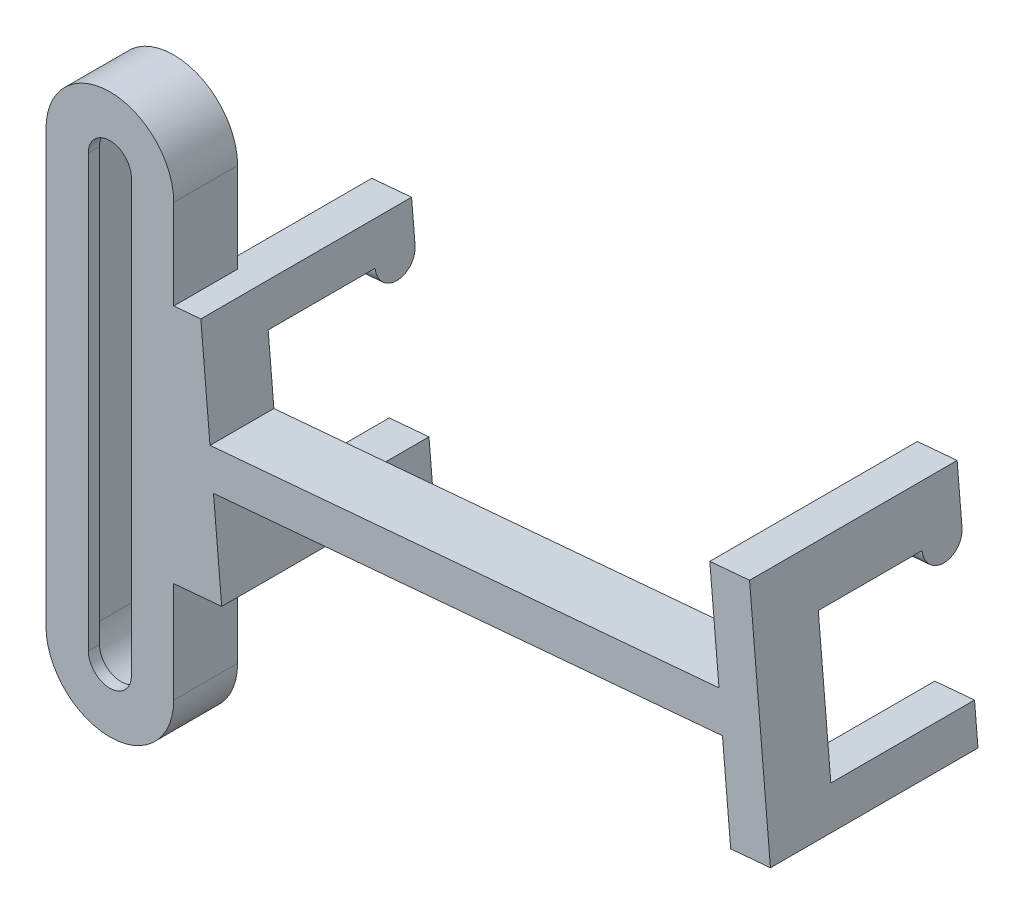
from build123d import *

# Parameters (mm, degrees)
SKETCH1_R           = 10.16
SKETCH1_W           = 20.32
SKETCH1_H           = 68.58
BOSS_EXTRUDE1_DEPTH = 10.16
SKETCH2_R           = 6.604
SKETCH2_W           = 13.208
SKETCH2_H           = 68.58
CUT_EXTRUDE1_DEPTH  = 47.714598361
BOSS_EXTRUDE2_DEPTH = 10.16
SKETCH4_W           = 33.528
SKETCH4_H           = 38.1
BOSS_EXTRUDE3_DEPTH = 6.35
SKETCH5_W           = 23.368
SKETCH5_H           = 25.4
CUT_EXTRUDE2_DEPTH  = 102.646087633
SKETCH6_W           = 33.02
SKETCH6_H           = 38.1
BOSS_EXTRUDE4_DEPTH = 6.35
BOSS_EXTRUDE5_REACH = 110.063
SKETCH7_W           = 10.16
SKETCH7_H           = 14.989497654
SKETCH8_W           = 22.86
SKETCH8_H           = 22.86
CUT_EXTRUDE3_DEPTH  = 122.879251037
SKETCH9_R           = 3.175
BOSS_EXTRUDE6_DEPTH = 6.35
SKETCH10_R          = 3.175
BOSS_EXTRUDE7_DEPTH = 6.35
SKETCH13_R          = 2.286
CUT_EXTRUDE4_DEPTH  = 81.28
BOSS_EXTRUDE8_START = -1.778
BOSS_EXTRUDE8_DEPTH = 1.778


with BuildPart() as part:
    # Sketch1 → Boss-Extrude1 (new body)
    with BuildSketch(Plane.XY):
        with Locations((0, 34.29)):
            Circle(SKETCH1_R)
        with Locations((0, -34.29)):
            Circle(SKETCH1_R)
        Rectangle(SKETCH1_W, SKETCH1_H)
    extrude(amount=BOSS_EXTRUDE1_DEPTH)

    # Sketch2 → Cut-Extrude1 (cut, through all)
    with BuildSketch(Plane.XY.offset(10.16)):
        with Locations((0, 34.29)):
            Circle(SKETCH2_R)
        with Locations((0, -34.29)):
            Circle(SKETCH2_R)
        Rectangle(SKETCH2_W, SKETCH2_H)
    extrude(amount=-CUT_EXTRUDE1_DEPTH, mode=Mode.SUBTRACT)

    # Sketch3 → Boss-Extrude2 (add)
    with BuildSketch(Plane(origin=(0, 0, 0), x_dir=(-1, 0, 0), z_dir=(0, 0, -1))):
        Polygon((-9.606561034, 3.138708349), (-103.22893876, 11.329605052), (-103.782377727, 5.003768719), (-10.16, -3.187127984), align=None)
    extrude(amount=-BOSS_EXTRUDE2_DEPTH)

    # Sketch4 → Boss-Extrude3 (add)
    with BuildSketch(Plane(origin=(-103.08224956, 1291.177707373, 0), x_dir=(0, 0, -1), z_dir=(-0.9961946980917459, -0.08715574274765499, 0))):
        with Locations((6.604, 1295.248596403)):
            Rectangle(SKETCH4_W, SKETCH4_H)
    extrude(amount=-BOSS_EXTRUDE3_DEPTH)

    # Sketch5 → Cut-Extrude2 (cut, through all)
    with BuildSketch(Plane(origin=(16.131940235, 1.411361891, 0), x_dir=(0, 0, 1), z_dir=(0.9961946980917458, 0.08715574274765524, 0))):
        with Locations((-11.684, 0)):
            Rectangle(SKETCH5_W, SKETCH5_H)
    extrude(amount=-CUT_EXTRUDE2_DEPTH, mode=Mode.SUBTRACT)

    # Sketch6 → Boss-Extrude4 (add)
    with BuildSketch(Plane(origin=(103.428481629, 9.048819628, 0), x_dir=(0, 0, -1), z_dir=(0.9961946980917468, 0.08715574274764347, 0))):
        with Locations((6.35, 0)):
            Rectangle(SKETCH6_W, SKETCH6_H)
    extrude(amount=-BOSS_EXTRUDE4_DEPTH)

    # Sketch7 → Boss-Extrude5 (add, up to next)
    with BuildSketch(Plane(origin=(9.806103902, 0.857922925, 0), x_dir=(0, 0, 1), z_dir=(-0.9961946980917458, -0.08715574274765528, 0)), mode=Mode.PRIVATE) as boss_extrude5_sk1:
        with Locations((5.08, -11.555251173)):
            Rectangle(SKETCH7_W, SKETCH7_H)
    boss_extrude5_tool1 = extrude(boss_extrude5_sk1.sketch, amount=BOSS_EXTRUDE5_REACH, mode=Mode.PRIVATE) - part.part
    add(boss_extrude5_tool1.solids().sort_by_distance((10.81321, -10.653357, 5.08))[0])

    # Sketch8 → Cut-Extrude3 (cut, through all)
    with BuildSketch(Plane(origin=(97.102645296, 8.495380662, 0), x_dir=(0, 0, 1), z_dir=(-0.9961946980917469, -0.08715574274764348, 0))):
        with Locations((-11.43, -1.27)):
            Rectangle(SKETCH8_W, SKETCH8_H)
    extrude(amount=-CUT_EXTRUDE3_DEPTH, mode=Mode.SUBTRACT)

    # Sketch9 → Boss-Extrude6 (add)
    with BuildSketch(Plane(origin=(9.806103902, 0.857922925, 0), x_dir=(0, 0, 1), z_dir=(-0.9961946980917459, -0.0871557427476546, 0))):
        with Locations((-20.193, 12.7)):
            Circle(SKETCH9_R)
    extrude(amount=-BOSS_EXTRUDE6_DEPTH)

    # Sketch10 → Boss-Extrude7 (add)
    with BuildSketch(Plane(origin=(97.102645296, 8.495380662, 0), x_dir=(0, 0, 1), z_dir=(-0.9961946980917469, -0.08715574274764348, 0))):
        with Locations((-19.685, 10.16)):
            Circle(SKETCH10_R)
    extrude(amount=-BOSS_EXTRUDE7_DEPTH)

    # Sketch13 → Cut-Extrude4 (cut)
    with BuildSketch(Plane(origin=(16.131940235, 1.411361891, 0), x_dir=(0, 0, -1), z_dir=(0.9961946980917459, 0.0871557427476546, 0))):
        with Locations((-5.08, -4.060502346)):
            Circle(SKETCH13_R)
    extrude(amount=CUT_EXTRUDE4_DEPTH, mode=Mode.SUBTRACT)

    # Sketch14 → Boss-Extrude8 (add)
    with BuildSketch(Plane.XY.offset(10.16).offset(BOSS_EXTRUDE8_START)):
        with BuildLine():
            Line((-10.16, -34.29), (-10.16, 34.29))
            ThreePointArc((-10.16, 34.29), (0, 44.45), (10.16, 34.29))
            Line((10.16, 34.29), (10.16, -34.29))
            ThreePointArc((10.16, -34.29), (0, -44.45), (-10.16, -34.29))
        make_face()
        with BuildLine():
            Line((-3.429, -34.29), (-3.429, 34.29))
            ThreePointArc((-3.429, 34.29), (0, 37.719), (3.429, 34.29))
            Line((3.429, 34.29), (3.429, -34.29))
            ThreePointArc((3.429, -34.29), (0, -37.719), (-3.429, -34.29))
        make_face(mode=Mode.SUBTRACT)
    extrude(amount=BOSS_EXTRUDE8_DEPTH)


solid = part.part
